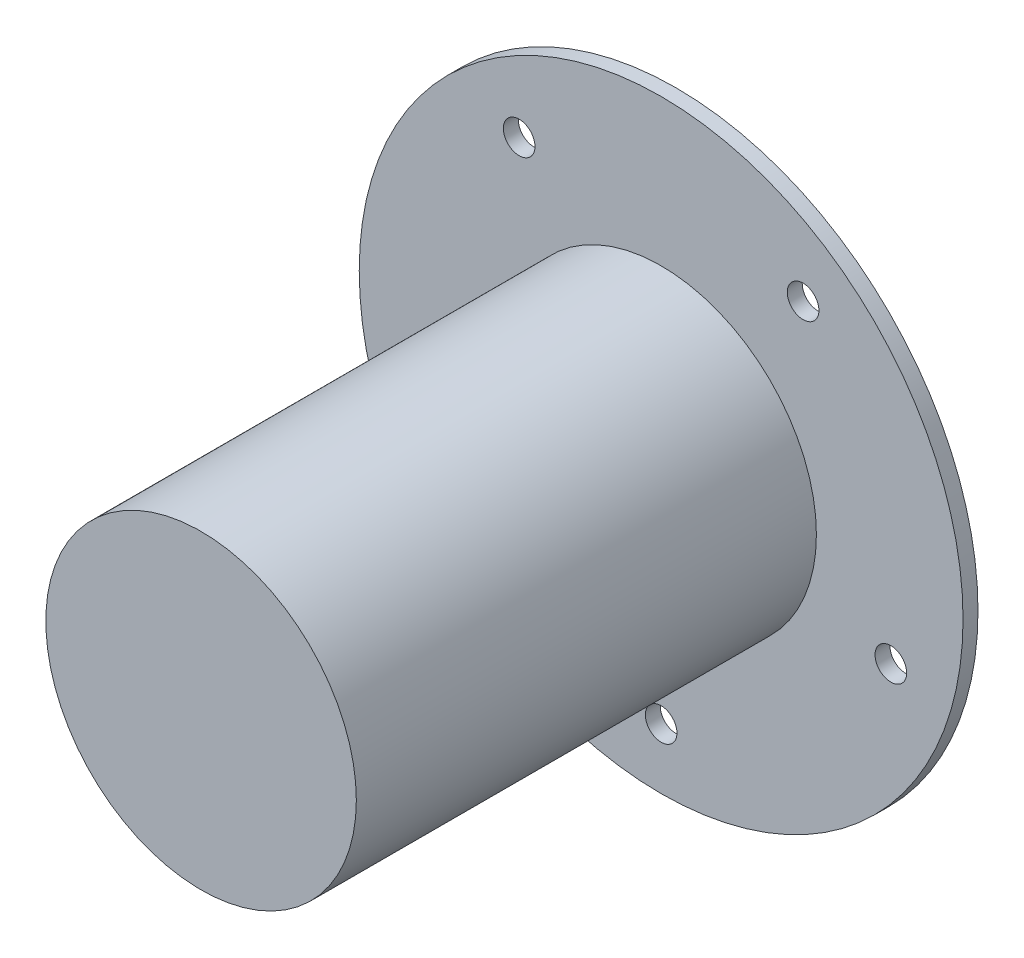
from build123d import *

# Parameters (mm, degrees)
SKETCH1_R           = 52.5
BOSS_EXTRUDE1_DEPTH = 2.6
SKETCH2_R           = 27
BOSS_EXTRUDE2_DEPTH = 80
SKETCH3_R           = 2.75
CUT_EXTRUDE1_DEPTH  = 110.144399765
CIRPATTERN1_COUNT   = 5


with BuildPart() as part:
    # Sketch1 → Boss-Extrude1 (new body)
    with BuildSketch(Plane.XY):
        Circle(SKETCH1_R)
    extrude(amount=-BOSS_EXTRUDE1_DEPTH)

    # Sketch2 → Boss-Extrude2 (add)
    with BuildSketch(Plane.XY):
        Circle(SKETCH2_R)
    extrude(amount=BOSS_EXTRUDE2_DEPTH)

    # Sketch3 → Cut-Extrude1 (cut, through all)
    with BuildSketch(Plane.XY):
        with Locations((-39.944373684, -12.978713764)):
            Circle(SKETCH3_R)
    cut_extrude1 = extrude(amount=-CUT_EXTRUDE1_DEPTH, mode=Mode.SUBTRACT)

    # CirPattern1: Cut-Extrude1 ×5 about axis
    cirpattern1_axis = Axis((0, 0, 0), (0, 0, 1))
    for i in range(1, CIRPATTERN1_COUNT):
        add(cut_extrude1.rotate(cirpattern1_axis, i * 360 / CIRPATTERN1_COUNT), mode=Mode.SUBTRACT)


solid = part.part
